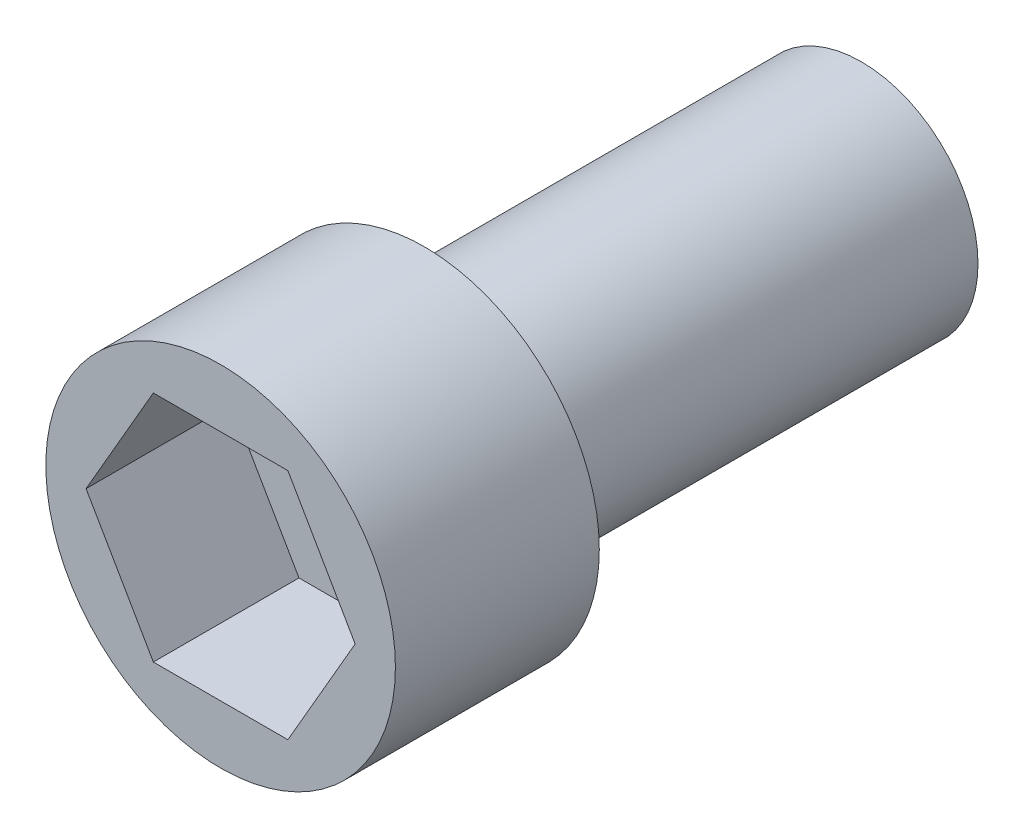
from build123d import *

# Parameters (mm, degrees)
SKETCH1_R           = 6
BOSS_EXTRUDE1_DEPTH = 7
SKETCH1_3_R         = 4
BOSS_EXTRUDE2_DEPTH = 22
CUT_EXTRUDE1_DEPTH  = 5


with BuildPart() as part:
    # Sketch1 → Boss-Extrude1 (new body)
    with BuildSketch(Plane.XY):
        Circle(SKETCH1_R)
    extrude(amount=-BOSS_EXTRUDE1_DEPTH)

    # Sketch1<3> → Boss-Extrude2 (add)
    with BuildSketch(Plane.XY):
        Circle(SKETCH1_3_R)
    extrude(amount=-BOSS_EXTRUDE2_DEPTH)

    # Sketch1<4> → Cut-Extrude1 (cut)
    with BuildSketch(Plane.XY):
        Polygon((4.618802154, 0), (2.309401077, 4), (-2.309401077, 4), (-4.618802154, 0), (-2.309401077, -4), (2.309401077, -4), align=None)
    extrude(amount=-CUT_EXTRUDE1_DEPTH, mode=Mode.SUBTRACT)


solid = part.part
